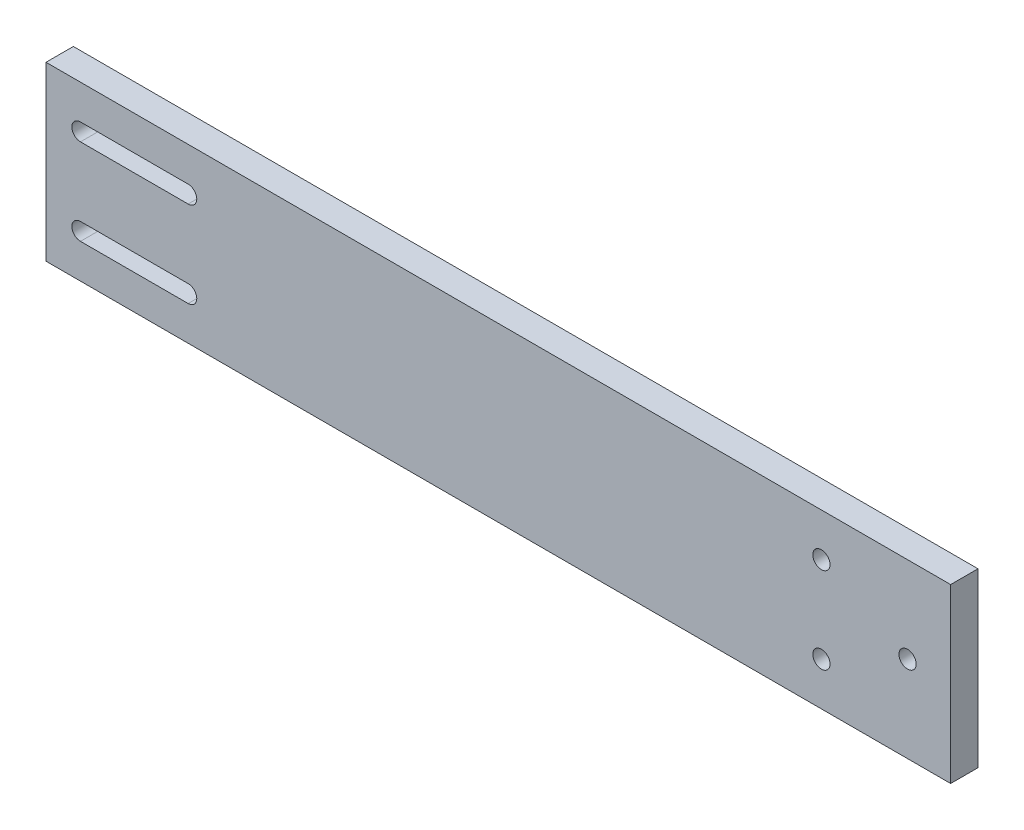
from build123d import *

# Parameters (mm, degrees)
SKETCH1_W           = 210
SKETCH1_H           = 40
SKETCH1_R           = 2
BOSS_EXTRUDE1_DEPTH = 6.35


with BuildPart() as part:
    # Sketch1 → Boss-Extrude1 (new body)
    with BuildSketch(Plane.XY):
        with Locations((105, 20)):
            Rectangle(SKETCH1_W, SKETCH1_H)
        with Locations((180, 30)):
            Circle(SKETCH1_R, mode=Mode.SUBTRACT)
        with Locations((180, 10)):
            Circle(SKETCH1_R, mode=Mode.SUBTRACT)
        with Locations((200, 20)):
            Circle(SKETCH1_R, mode=Mode.SUBTRACT)
        with BuildLine():
            Line((8, 32), (33, 32))
            ThreePointArc((33, 32), (35, 30), (33, 28))
            Line((33, 28), (8, 28))
            ThreePointArc((8, 28), (6, 30), (8, 32))
        make_face(mode=Mode.SUBTRACT)
        with BuildLine():
            Line((8, 12), (33, 12))
            ThreePointArc((33, 12), (35, 10), (33, 8))
            Line((33, 8), (8, 8))
            ThreePointArc((8, 8), (6, 10), (8, 12))
        make_face(mode=Mode.SUBTRACT)
    extrude(amount=BOSS_EXTRUDE1_DEPTH)


solid = part.part
